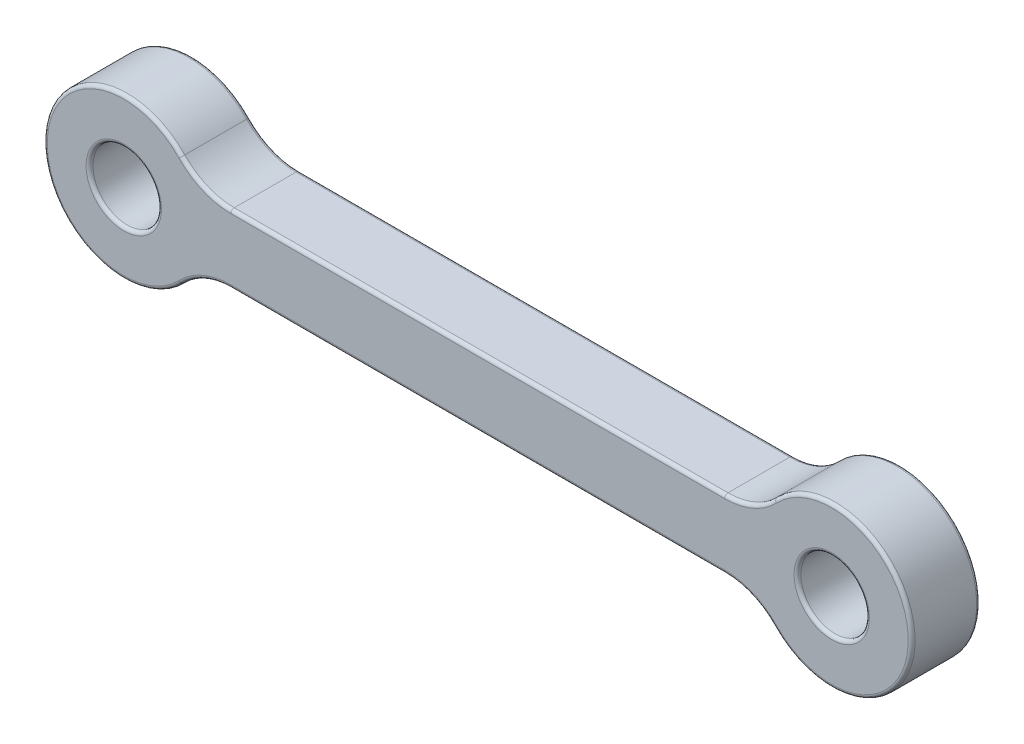
from build123d import *

# Parameters (mm, degrees)
SKETCH1_R           = 3.5
SKETCH1_R_2         = 1.5
BOSS_EXTRUDE1_DEPTH = 1.5
FILLET1_R           = 3
FILLET2_R           = 0.15


with BuildPart() as part:
    # Sketch1 → Boss-Extrude1 (new, symmetric)
    # profile 1 of 3: a face of its own
    with BuildSketch(Plane.XY):
        Circle(SKETCH1_R)
        Circle(SKETCH1_R_2, mode=Mode.SUBTRACT)
    # profile 2 of 3: a face of its own
    with BuildSketch(Plane.XY):
        with Locations((31, 0)):
            Circle(SKETCH1_R)
        with Locations((31, 0)):
            Circle(SKETCH1_R_2, mode=Mode.SUBTRACT)
    # profile 3 of 3: a face of its own
    with BuildSketch(Plane.XY):
        with BuildLine():
            Line((3.16227766, -1.5), (27.83772234, -1.5))
            ThreePointArc((27.83772234, -1.5), (27.5, 0), (27.83772234, 1.5))
            Line((27.83772234, 1.5), (3.16227766, 1.5))
            ThreePointArc((3.16227766, 1.5), (3.414525722, 0.768774411), (3.5, 0))
            ThreePointArc((3.5, 0), (3.414525722, -0.768774411), (3.16227766, -1.5))
        make_face()
    extrude(amount=BOSS_EXTRUDE1_DEPTH, both=True)

    # Fillet1
    fillet1_edges = [part.edges().sort_by_distance(p)[0] for p in [
        (3.16227766, 1.5, 0),
        (27.83772234, 1.5, 0),
        (27.83772234, -1.5, 0),
        (3.16227766, -1.5, 0),
    ]]
    fillet(fillet1_edges, radius=FILLET1_R)

    # Fillet2
    fillet2_edges = [part.edges().sort_by_distance(p)[0] for p in [
        (-1.5, 0, -1.5),
        (15.5, -1.5, -1.5),
        (15.5, -1.5, 1.5),
        (-3.5, 0, -1.5),
        (-3.5, 0, 1.5),
        (34.5, 0, -1.5),
        (34.5, 0, 1.5),
        (15.5, 1.5, -1.5),
        (15.5, 1.5, 1.5),
        (3.513718949, -1.740401367, -1.5),
        (3.513718949, -1.740401367, 1.5),
        (27.486281051, -1.740401367, -1.5),
        (29.5, 0, 1.5),
        (27.486281051, -1.740401367, 1.5),
        (27.486281051, 1.740401367, -1.5),
        (27.486281051, 1.740401367, 1.5),
        (3.513718949, 1.740401367, -1.5),
        (3.513718949, 1.740401367, 1.5),
        (-1.5, 0, 1.5),
        (29.5, 0, -1.5),
    ]]
    fillet(fillet2_edges, radius=FILLET2_R)


solid = part.part
